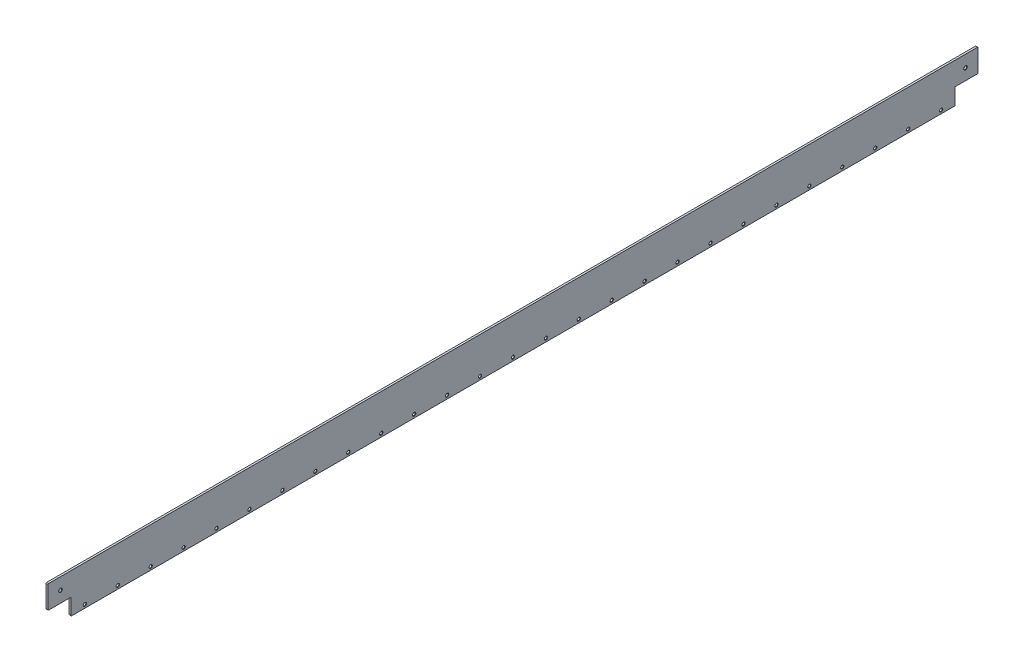
from build123d import *

# Parameters (mm, degrees)
BOSS_EXTRUDE1_DEPTH            = 3
SKETCH2_R                      = 2
CUT_EXTRUDE1_DEPTH             = 3
CHAMFER1_SIZE                  = 0.5
LPATTERN1_COUNT                = 14
LPATTERN1_PITCH                = 50
CHAMFER1_OF_LPATTERN1_SIZE     = 0.5
LPATTERN1_COL_COUNT            = 14
LPATTERN1_COL_PITCH            = 50
CHAMFER1_OF_LPATTERN1_COL_SIZE = 0.5
FILLET1_R                      = 1
SKETCH3_R                      = 2.25
CUT_EXTRUDE2_DEPTH             = 10
CHAMFER2_SIZE                  = 0.5
CHAMFER2_OF_MIRROR1_SIZE       = 0.5


with BuildPart() as part:
    # Sketch1 → Boss-Extrude1 (new body)
    with BuildSketch(Plane(origin=(0, 0, 0), x_dir=(0, 0, -1), z_dir=(1, 0, 0))):
        Polygon((-706, 30), (-706, -5), (-671, -5), (-671, -30), (671, -30), (671, -5), (706, -5), (706, 30), align=None)
    extrude(amount=BOSS_EXTRUDE1_DEPTH)

    # Sketch2 → Cut-Extrude1 (cut)
    with BuildSketch(Plane(origin=(3, 0, 0), x_dir=(0, 0, -1), z_dir=(1, 0, 0))):
        with Locations((0, -25)):
            Circle(SKETCH2_R)
    cut_extrude1 = extrude(amount=-CUT_EXTRUDE1_DEPTH, mode=Mode.SUBTRACT)

    # Chamfer1
    chamfer1_edges = [part.edges().sort_by_distance(p)[0] for p in [
        (3, -25, 2),
    ]]
    chamfer(chamfer1_edges, length=CHAMFER1_SIZE)

    # LPattern1: Cut-Extrude1 ×14
    with Locations(*[(0, 0, i * LPATTERN1_PITCH) for i in range(1, LPATTERN1_COUNT)]):
        add(cut_extrude1, mode=Mode.SUBTRACT)

    # Chamfer1 of LPattern1
    chamfer1_of_lpattern1_edges = [part.edges().sort_by_distance(p)[0] for p in [
        (3, -25, 52),
        (3, -25, 102),
        (3, -25, 152),
        (3, -25, 202),
        (3, -25, 252),
        (3, -25, 302),
        (3, -25, 352),
        (3, -25, 402),
        (3, -25, 452),
        (3, -25, 502),
        (3, -25, 552),
        (3, -25, 602),
        (3, -25, 652),
    ]]
    chamfer(chamfer1_of_lpattern1_edges, length=CHAMFER1_OF_LPATTERN1_SIZE)

    # LPattern1 col: Cut-Extrude1 ×14
    with Locations(*[(0, 0, -i * LPATTERN1_COL_PITCH) for i in range(1, LPATTERN1_COL_COUNT)]):
        add(cut_extrude1, mode=Mode.SUBTRACT)

    # Chamfer1 of LPattern1 col
    chamfer1_of_lpattern1_col_edges = [part.edges().sort_by_distance(p)[0] for p in [
        (3, -25, -48),
        (3, -25, -98),
        (3, -25, -148),
        (3, -25, -198),
        (3, -25, -248),
        (3, -25, -298),
        (3, -25, -348),
        (3, -25, -398),
        (3, -25, -448),
        (3, -25, -498),
        (3, -25, -548),
        (3, -25, -598),
        (3, -25, -648),
    ]]
    chamfer(chamfer1_of_lpattern1_col_edges, length=CHAMFER1_OF_LPATTERN1_COL_SIZE)

    # Fillet1
    fillet1_edges = [part.edges().sort_by_distance(p)[0] for p in [
        (1.5, -5, -706),
        (1.5, -30, -671),
        (1.5, -30, 671),
        (1.5, -5, 706),
        (1.5, 30, 706),
        (1.5, 30, -706),
    ]]
    fillet(fillet1_edges, radius=FILLET1_R)

    # Sketch3 → Cut-Extrude2 (cut)
    with BuildSketch(Plane(origin=(3, 0, 0), x_dir=(0, 0, -1), z_dir=(1, 0, 0))):
        with Locations((687, 12)):
            Circle(SKETCH3_R)
    cut_extrude2 = extrude(amount=-CUT_EXTRUDE2_DEPTH, mode=Mode.SUBTRACT)

    # Chamfer2
    chamfer2_edges = [part.edges().sort_by_distance(p)[0] for p in [
        (3, 12, -684.75),
    ]]
    chamfer(chamfer2_edges, length=CHAMFER2_SIZE)

    # Mirror1: Cut-Extrude2 across plane
    add(cut_extrude2.mirror(Plane.XY), mode=Mode.SUBTRACT)

    # Chamfer2 of Mirror1
    chamfer2_of_mirror1_edges = [part.edges().sort_by_distance(p)[0] for p in [
        (3, 12, 684.75),
    ]]
    chamfer(chamfer2_of_mirror1_edges, length=CHAMFER2_OF_MIRROR1_SIZE)


solid = part.part
